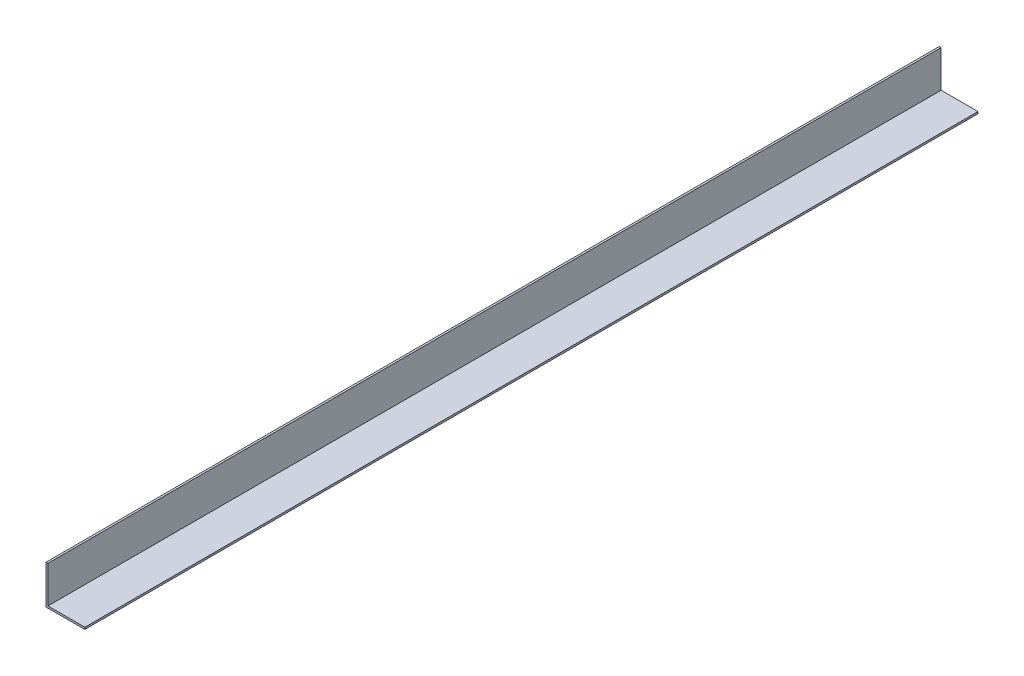
from build123d import *

# Parameters (mm, degrees)
EXTRUDE_1_DEPTH = 460


with BuildPart() as part:
    # 草图1 → 凸台-拉伸1 (new body)
    with BuildSketch(Plane.XY):
        Polygon((0, 0), (0, 20), (1, 20), (1, 1), (20, 1), (20, 0), align=None)
    extrude(amount=EXTRUDE_1_DEPTH)


solid = part.part
